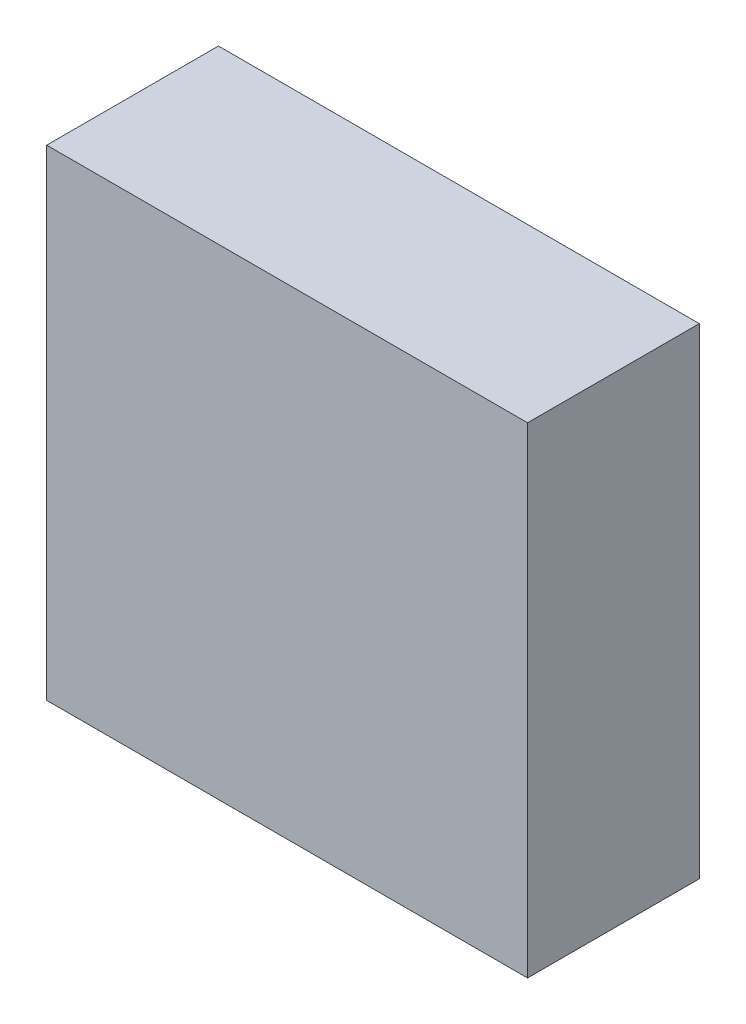
from build123d import *

# Parameters (mm, degrees)
SKETCH1_W           = 28
SKETCH1_H           = 28
BOSS_EXTRUDE1_DEPTH = 10


with BuildPart() as part:
    # Sketch1 → Boss-Extrude1 (new body)
    with BuildSketch(Plane.XY):
        Rectangle(SKETCH1_W, SKETCH1_H)
    extrude(amount=-BOSS_EXTRUDE1_DEPTH)


solid = part.part
